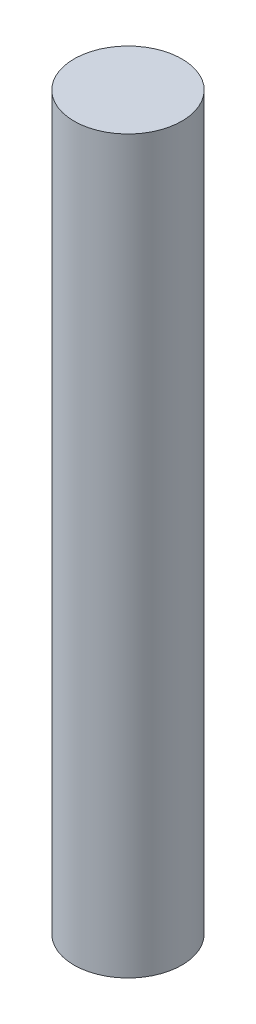
from build123d import *

# Parameters (mm, degrees)
SKETCH1_R           = 2.95
BOSS_EXTRUDE1_DEPTH = 40


with BuildPart() as part:
    # Sketch1 → Boss-Extrude1 (new body)
    with BuildSketch(Plane(origin=(0, 0, 0), x_dir=(1, 0, 0), z_dir=(0, 1, 0))):
        Circle(SKETCH1_R)
    extrude(amount=BOSS_EXTRUDE1_DEPTH)


solid = part.part
